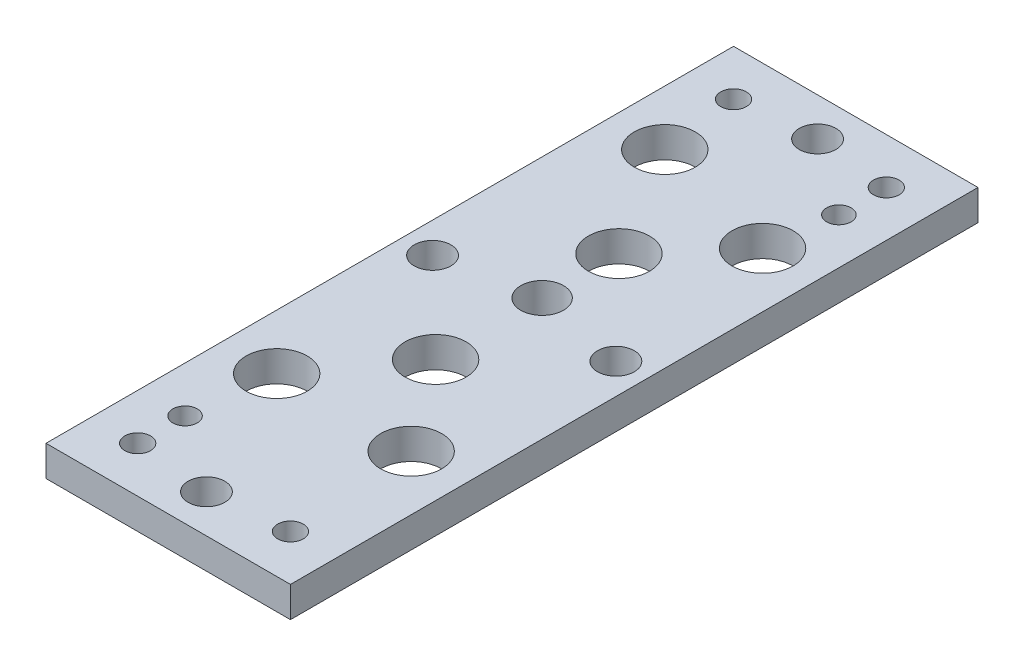
from build123d import *

# Parameters (mm, degrees)
SKETCH1_W             = 80
SKETCH1_H             = 225
BOSS_EXTRUDE1_DEPTH   = 10
CUT_EXTRUDE1_REACH    = 121.818
SKETCH2_R             = 6
M8_CLEARANCE_HOLE1_D  = 8.4
F_8_0MM_DOWEL_HOLE1_D = 8
CUT_EXTRUDE3_REACH    = 121.818
SKETCH10_R            = 7
SKETCH14_R            = 10
CUT_EXTRUDE4_DEPTH    = 120.817569663


with BuildPart() as part:
    # Sketch1 → Boss-Extrude1 (new body)
    with BuildSketch(Plane(origin=(0, 0, 0), x_dir=(1, 0, 0), z_dir=(0, 1, 0))):
        Rectangle(SKETCH1_W, SKETCH1_H)
    extrude(amount=-BOSS_EXTRUDE1_DEPTH)

    # Sketch2 → Cut-Extrude1 (cut, up to next)
    with BuildSketch(Plane(origin=(0, 0, 0), x_dir=(1, 0, 0), z_dir=(0, 1, 0)), mode=Mode.PRIVATE) as cut_extrude1_sk1:
        with Locations(Location((0, 100, 0), (0, 0, 270))):
            Circle(SKETCH2_R)
    cut_extrude1_tool1 = extrude(cut_extrude1_sk1.sketch, amount=-CUT_EXTRUDE1_REACH, mode=Mode.PRIVATE) & part.part
    # Sketch2 → Cut-Extrude1 (cut, up to next)
    with BuildSketch(Plane(origin=(0, 0, 0), x_dir=(1, 0, 0), z_dir=(0, 1, 0)), mode=Mode.PRIVATE) as cut_extrude1_sk2:
        with Locations(Location((30, 4, 0), (0, 0, 270))):
            Circle(SKETCH2_R)
    cut_extrude1_tool2 = extrude(cut_extrude1_sk2.sketch, amount=-CUT_EXTRUDE1_REACH, mode=Mode.PRIVATE) & part.part
    # Sketch2 → Cut-Extrude1 (cut, up to next)
    with BuildSketch(Plane(origin=(0, 0, 0), x_dir=(1, 0, 0), z_dir=(0, 1, 0)), mode=Mode.PRIVATE) as cut_extrude1_sk3:
        with Locations(Location((-30, 4, 0), (0, 0, 270))):
            Circle(SKETCH2_R)
    cut_extrude1_tool3 = extrude(cut_extrude1_sk3.sketch, amount=-CUT_EXTRUDE1_REACH, mode=Mode.PRIVATE) & part.part
    # Sketch2 → Cut-Extrude1 (cut, up to next)
    with BuildSketch(Plane(origin=(0, 0, 0), x_dir=(1, 0, 0), z_dir=(0, 1, 0)), mode=Mode.PRIVATE) as cut_extrude1_sk4:
        with Locations(Location((0, -100, 0), (0, 0, 270))):
            Circle(SKETCH2_R)
    cut_extrude1_tool4 = extrude(cut_extrude1_sk4.sketch, amount=-CUT_EXTRUDE1_REACH, mode=Mode.PRIVATE) & part.part
    add(cut_extrude1_tool1.solids().sort_by_distance((0, 0, -100))[0], mode=Mode.SUBTRACT)
    add(cut_extrude1_tool2.solids().sort_by_distance((30, 0, -4))[0], mode=Mode.SUBTRACT)
    add(cut_extrude1_tool3.solids().sort_by_distance((-30, 0, -4))[0], mode=Mode.SUBTRACT)
    add(cut_extrude1_tool4.solids().sort_by_distance((0, 0, 100))[0], mode=Mode.SUBTRACT)

    # M8 Clearance Hole1 (through all)
    with Locations(Plane(origin=(0, 0, 0), x_dir=(1, 0, 0), z_dir=(0, 1, 0))):
        with Locations((-25, 97.5), (25, 97.5), (25, -97.5), (-25, -97.5)):
            Hole(M8_CLEARANCE_HOLE1_D / 2)

    # Ø8.0mm Dowel Hole1 (through all)
    with Locations(Plane(origin=(0, 0, 0), x_dir=(1, 0, 0), z_dir=(0, 1, 0))):
        with Locations((25, 81.975), (-25, -82)):
            Hole(F_8_0MM_DOWEL_HOLE1_D / 2)

    # Sketch10 → Cut-Extrude3 (cut, up to next)
    with BuildSketch(Plane(origin=(0, 0, 0), x_dir=(1, 0, 0), z_dir=(0, 1, 0)), mode=Mode.PRIVATE) as cut_extrude3_sk1:
        with Locations(Location((0, 9.86, 0), (0, 0, 270))):
            Circle(SKETCH10_R)
    cut_extrude3_tool1 = extrude(cut_extrude3_sk1.sketch, amount=-CUT_EXTRUDE3_REACH, mode=Mode.PRIVATE) & part.part
    add(cut_extrude3_tool1.solids().sort_by_distance((0, 0, -9.86))[0], mode=Mode.SUBTRACT)

    # Sketch14 → Cut-Extrude4 (cut, through all)
    with BuildSketch(Plane(origin=(0, -10, 0), x_dir=(1, 0, 0), z_dir=(0, 1, 0))):
        with Locations(Location((22, 60, 0), (0, 0, 270))):
            Circle(SKETCH14_R)
        with Locations(Location((-22, 72, 0), (0, 0, 270))):
            Circle(SKETCH14_R)
        with Locations(Location((0, 35, 0), (0, 0, 270))):
            Circle(SKETCH14_R)
        with Locations(Location((0, -25, 0), (0, 0, 270))):
            Circle(SKETCH14_R)
        with Locations(Location((-22, -55, 0), (0, 0, 270))):
            Circle(SKETCH14_R)
        with Locations(Location((22, -55, 0), (0, 0, 270))):
            Circle(SKETCH14_R)
    extrude(amount=CUT_EXTRUDE4_DEPTH, mode=Mode.SUBTRACT)


solid = part.part
